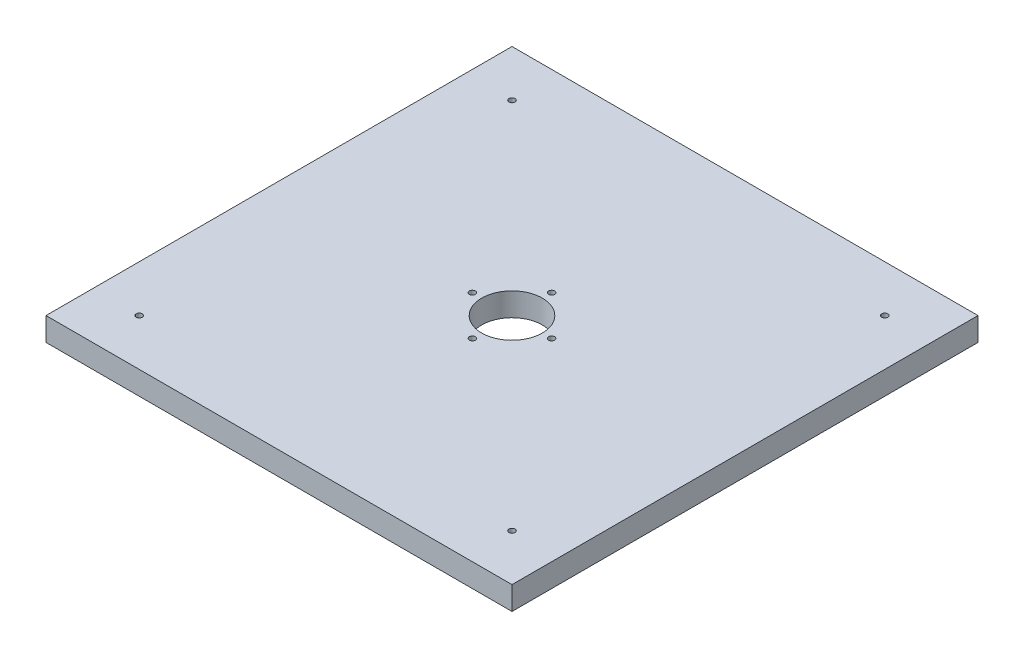
from build123d import *

# Parameters (mm, degrees)
SKETCH1_W                   = 200
SKETCH1_H                   = 200
BOSS_EXTRUDE1_DEPTH         = 10
CUT_EXTRUDE2_DEPTH          = 284.019433962
CUT_EXTRUDE2_DEPTH_BACK     = 284.019433962
SKETCH2_R                   = 13
TAP_DRILL_FOR_M3X0_5_TAP1_D = 2.6


with BuildPart() as part:
    # Sketch1 → Boss-Extrude1 (new body)
    with BuildSketch(Plane(origin=(0, 0, 0), x_dir=(1, 0, 0), z_dir=(0, 1, 0))):
        with Locations((100, 100)):
            Rectangle(SKETCH1_W, SKETCH1_H)
    extrude(amount=BOSS_EXTRUDE1_DEPTH)

    # Sketch2 → Cut-Extrude2 (cut, two sides: drawn at the far end of the back side and taken through both)
    with BuildSketch(Plane(origin=(0, 0, 0), x_dir=(1, 0, 0), z_dir=(0, 1, 0)).offset(-CUT_EXTRUDE2_DEPTH_BACK)):
        with Locations(Location((100, 100, 0), (0, 0, 270))):
            Circle(SKETCH2_R)
    extrude(amount=CUT_EXTRUDE2_DEPTH + CUT_EXTRUDE2_DEPTH_BACK, mode=Mode.SUBTRACT)

    # Tap Drill for M3x0.5 Tap1 (through all)
    with Locations(Plane(origin=(0, 10, 0), x_dir=(1, 0, 0), z_dir=(0, 1, 0))):
        with Locations((20, 180), (180, 180), (180, 20), (20, 20), (100, 117), (117, 100), (100, 83), (83, 100)):
            Hole(TAP_DRILL_FOR_M3X0_5_TAP1_D / 2)


solid = part.part
